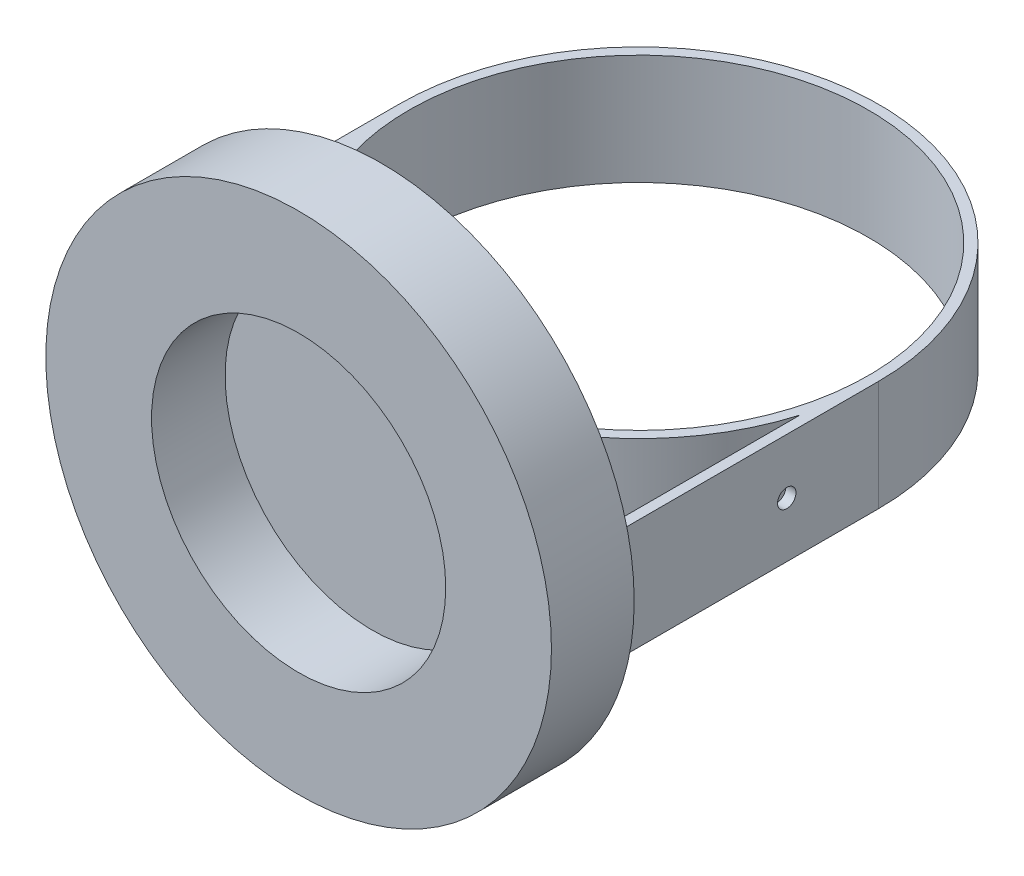
from build123d import *

# Parameters (mm, degrees)
SKETCH1_R                = 27.5
BOSS_EXTRUDE1_DEPTH      = 1
SKETCH2_R                = 27.5
SKETCH2_R_2              = 16
BOSS_EXTRUDE2_DEPTH      = 8
SKETCH3_W                = 1.095229805
SKETCH3_H                = 12
BOSS_EXTRUDE3_DEPTH      = 28
BOSS_EXTRUDE4_DEPTH      = 6
BOSS_EXTRUDE4_DEPTH_BACK = 6
CUT_EXTRUDE1_DEPTH       = 67.624274012
CUT_EXTRUDE1_DEPTH_BACK  = 67.624274012
SKETCH4_R                = 1


with BuildPart() as part:
    # Sketch1 → Boss-Extrude1 (new body)
    with BuildSketch(Plane.XY):
        Circle(SKETCH1_R)
    extrude(amount=BOSS_EXTRUDE1_DEPTH)

    # Sketch2 → Boss-Extrude2 (add)
    with BuildSketch(Plane.XY.offset(1)):
        Circle(SKETCH2_R)
        Circle(SKETCH2_R_2, mode=Mode.SUBTRACT)
    extrude(amount=BOSS_EXTRUDE2_DEPTH)

    # Sketch3 → Boss-Extrude3 (add)
    with BuildSketch(Plane(origin=(0, 0, 0), x_dir=(-1, 0, 0), z_dir=(0, 0, -1))):
        with Locations((-25.547614903, 0)):
            Rectangle(SKETCH3_W, SKETCH3_H)
        with Locations((25.547614903, 0)):
            Rectangle(SKETCH3_W, SKETCH3_H)
    extrude(amount=BOSS_EXTRUDE3_DEPTH)

    # Sketch6 → Boss-Extrude4 (add, two sides: drawn at the far end of the back side and taken through both)
    with BuildSketch(Plane(origin=(0, 0, 0), x_dir=(1, 0, 0), z_dir=(0, 1, 0)).offset(-BOSS_EXTRUDE4_DEPTH_BACK)):
        with BuildLine():
            ThreePointArc((-26.095229805, 28), (0, 54.095229805), (26.095229805, 28))
            ThreePointArc((26.095229805, 28), (0, 1.904770195), (-26.095229805, 28))
        make_face()
        with BuildLine():
            ThreePointArc((-25, 28), (0, 53), (25, 28))
            ThreePointArc((25, 28), (0, 3), (-25, 28))
        make_face(mode=Mode.SUBTRACT)
    extrude(amount=BOSS_EXTRUDE4_DEPTH + BOSS_EXTRUDE4_DEPTH_BACK)

    # Sketch4 → Cut-Extrude1 (cut, two sides: drawn at the far end of the back side and taken through both)
    with BuildSketch(Plane(origin=(0, 0, 0), x_dir=(0, 0, -1), z_dir=(1, 0, 0)).offset(-CUT_EXTRUDE1_DEPTH_BACK)):
        with Locations((18, 0)):
            Circle(SKETCH4_R)
    extrude(amount=CUT_EXTRUDE1_DEPTH + CUT_EXTRUDE1_DEPTH_BACK, mode=Mode.SUBTRACT)


solid = part.part
